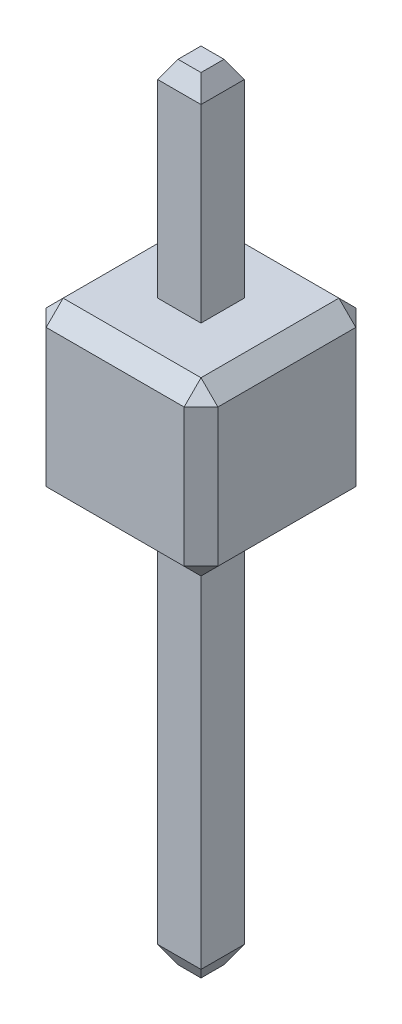
from build123d import *
from OCP.BRepFilletAPI import BRepFilletAPI_MakeChamfer

# Parameters (mm, degrees)
ESBO_O1_W                = 0.64
ESBO_O1_H                = 11.6
RESSALTO_EXTRUS_O1_DEPTH = 0.32
ESBO_O2_W                = 2.54
ESBO_O2_H                = 2.54
RESSALTO_EXTRUS_O2_DEPTH = 1.27
CHANFRO1_SIZE            = 0.15
CHANFRO1_SIZE2           = 0.26
CHANFRO2_SIZE            = 0.26
CHANFRO2_SIZE2           = 0.15
CHANFRO3_SIZE            = 0.25


with BuildPart() as part:
    # Esboço1 → Ressalto-extrusão1 (new, symmetric)
    with BuildSketch(Plane.XY):
        Rectangle(ESBO_O1_W, ESBO_O1_H)
    extrude(amount=RESSALTO_EXTRUS_O1_DEPTH, both=True)

    # Esboço2 → Ressalto-extrusão2 (add, symmetric)
    with BuildSketch(Plane.XY):
        with Locations((0, 1.47)):
            Rectangle(ESBO_O2_W, ESBO_O2_H)
    extrude(amount=RESSALTO_EXTRUS_O2_DEPTH, both=True)

    # Chanfro1
    chanfro1_edges = [part.edges().sort_by_distance(p)[0] for p in [
        (0, 5.8, -0.32),
        (-0.32, 5.8, 0),
        (0.32, 5.8, 0),
        (0, 5.8, 0.32),
    ]]
    chanfro1_side = [part.faces().sort_by_distance(p)[0] for p in [
        (0, 5.8, 0),
    ]]
    chamfer(chanfro1_edges, length=CHANFRO1_SIZE, length2=CHANFRO1_SIZE2, reference=chanfro1_side[0])

    # Chanfro2: one chamfer whose edges measure the first distance from different faces: ONE call of the kernel's chamfer builder (chamfer() names one face for all edges)
    chanfro2_edges_1 = [part.edges().sort_by_distance(p)[0] for p in [
        (0, -5.8, 0.32),
    ]]
    chanfro2_side_1 = [part.faces().sort_by_distance(p)[0] for p in [
        (0, -2.8, 0.32),
    ]]
    chanfro2_edges_2 = [part.edges().sort_by_distance(p)[0] for p in [
        (0, -5.8, -0.32),
    ]]
    chanfro2_side_2 = [part.faces().sort_by_distance(p)[0] for p in [
        (0, -2.8, -0.32),
    ]]
    chanfro2_edges_3 = [part.edges().sort_by_distance(p)[0] for p in [
        (0.32, -5.8, 0),
    ]]
    chanfro2_side_3 = [part.faces().sort_by_distance(p)[0] for p in [
        (0.32, -2.8, 0),
    ]]
    chanfro2_edges_4 = [part.edges().sort_by_distance(p)[0] for p in [
        (-0.32, -5.8, 0),
    ]]
    chanfro2_side_4 = [part.faces().sort_by_distance(p)[0] for p in [
        (-0.32, -2.8, 0),
    ]]
    chanfro2 = BRepFilletAPI_MakeChamfer(part.part.solid().wrapped)
    for e in chanfro2_edges_1:
        chanfro2.Add(CHANFRO2_SIZE, CHANFRO2_SIZE2, e.wrapped, chanfro2_side_1[0].wrapped)  # the first distance lies on this face
    for e in chanfro2_edges_2:
        chanfro2.Add(CHANFRO2_SIZE, CHANFRO2_SIZE2, e.wrapped, chanfro2_side_2[0].wrapped)  # the first distance lies on this face
    for e in chanfro2_edges_3:
        chanfro2.Add(CHANFRO2_SIZE, CHANFRO2_SIZE2, e.wrapped, chanfro2_side_3[0].wrapped)  # the first distance lies on this face
    for e in chanfro2_edges_4:
        chanfro2.Add(CHANFRO2_SIZE, CHANFRO2_SIZE2, e.wrapped, chanfro2_side_4[0].wrapped)  # the first distance lies on this face
    add(Compound.cast(chanfro2.Shape()), mode=Mode.REPLACE)

    # Chanfro3
    chanfro3_edges = [part.edges().sort_by_distance(p)[0] for p in [
        (-1.27, 1.47, -1.27),
        (-1.27, 2.74, 0),
        (0, 0.2, -1.27),
        (-1.27, 0.2, 0),
        (1.27, 1.47, -1.27),
        (1.27, 0.2, 0),
        (0, 2.74, -1.27),
        (1.27, 2.74, 0),
        (-1.27, 1.47, 1.27),
        (0, 0.2, 1.27),
        (1.27, 1.47, 1.27),
        (0, 2.74, 1.27),
    ]]
    chamfer(chanfro3_edges, length=CHANFRO3_SIZE)


solid = part.part
